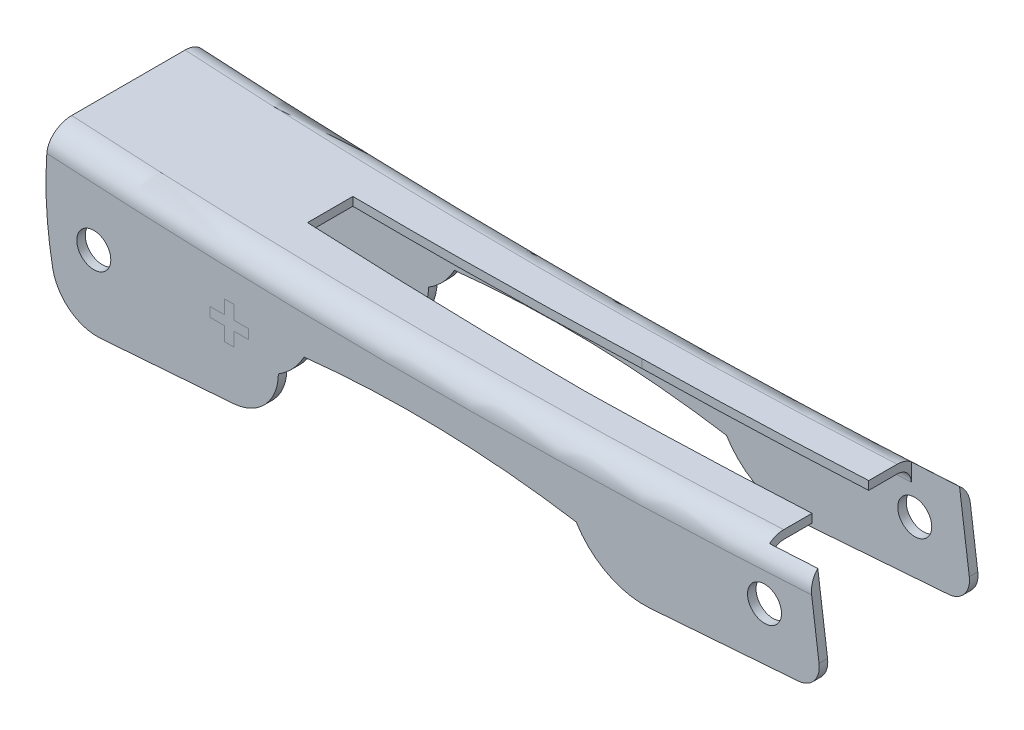
from build123d import *

# Parameters (mm, degrees)
BOSS_EXTRUDE1_DEPTH = 7
FILLET1_R           = 4
FILLET2_R           = 2
SHELL1_T            = -0.75
CUT_EXTRUDE1_DEPTH  = 14
SKETCH5_R           = 1.5
CUT_EXTRUDE2_DEPTH  = 71.716642035
CUT_EXTRUDE3_DEPTH  = 71.716642035


with BuildPart() as part:
    # Sketch2 → Boss-Extrude1 (new, symmetric)
    with BuildSketch(Plane.XY):
        with BuildLine():
            Line((67, 0), (68.2, -9))
            Line((68.2, -9), (1.2, -14))
            Line((1.2, -14), (0, 0))
            ThreePointArc((0, 0), (33.5, -1), (67, 0))
        make_face()
        with BuildLine():
            ThreePointArc((1.2, -14), (-0.147259987, -7.064050856), (0, 0))
            Line((0, 0), (1.2, -14))
        make_face()
    extrude(amount=BOSS_EXTRUDE1_DEPTH, both=True)

    # Fillet1
    fillet1_edges = [part.edges().sort_by_distance(p)[0] for p in [
        (1.2, -14, 0),
    ]]
    fillet(fillet1_edges, radius=FILLET1_R)

    # Fillet2
    fillet2_edges = [part.edges().sort_by_distance(p)[0] for p in [
        (33.5, -1, 7),
        (33.5, -1, -7),
        (68.2, -9, 0),
    ]]
    fillet(fillet2_edges, radius=FILLET2_R)

    # Shell1
    shell1_openings = [part.faces().sort_by_distance(p)[0] for p in [
        (67.467137389, -3.50353042, 6e-09),
        (1.829469038, -12.937587905, 0),
        (67.490186671, -8.423793277, 0),
        (35.321845663, -11.453593607, 0),
        (-0.252281581, -5.271781297, 0),
    ]]
    offset(amount=SHELL1_T, openings=shell1_openings)

    # Sketch4 → Cut-Extrude1 (cut)
    with BuildSketch(Plane(origin=(0, 0, 0), x_dir=(1, 0, 0), z_dir=(0, 1, 0))):
        Polygon((17.8, -2), (17.8, 2), (42.8, 2.5), (62.8, 2.5), (62.8, 6.25), (67.8, 6.25), (67.8, -6.25), (62.8, -6.25), (62.8, -2.5), (42.8, -2.5), align=None)
    extrude(amount=-CUT_EXTRUDE1_DEPTH, mode=Mode.SUBTRACT)

    # Sketch5 → Cut-Extrude2 (cut, through all)
    with BuildSketch(Plane.XY.offset(7)):
        with Locations((3.95, -7.3)):
            Circle(SKETCH5_R)
        with Locations((63.108141066, -4.736057992)):
            Circle(SKETCH5_R)
    extrude(amount=-CUT_EXTRUDE2_DEPTH, mode=Mode.SUBTRACT)

    # Sketch6 → Cut-Extrude3 (cut, through all)
    with BuildSketch(Plane.XY.offset(7)):
        with BuildLine():
            Line((16.25, -12.876865672), (53, -10.134328358))
            ThreePointArc((53, -10.134328358), (49.280996353, -9.38144837), (46.5, -6.8))
            ThreePointArc((46.5, -6.8), (34.520096022, -5.696159139), (22.5, -6.2))
            ThreePointArc((22.5, -6.2), (21.525014111, -7.562463141), (20.229840096, -8.625208437))
            ThreePointArc((20.229840096, -8.625208437), (19.06924649, -11.527342961), (16.25, -12.876865672))
        make_face()
    extrude(amount=-CUT_EXTRUDE3_DEPTH, mode=Mode.SUBTRACT)


solid = part.part
